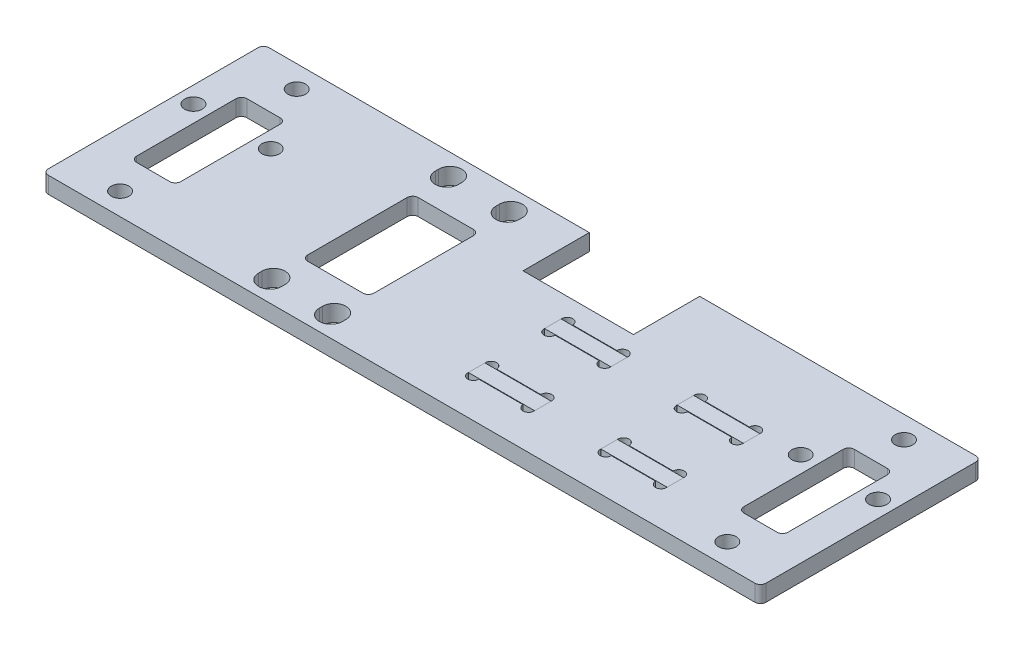
from build123d import *

# Parameters (mm, degrees)
SKETCH_1_W          = 130
SKETCH_1_H          = 40
SKETCH_1_R          = 1.6
EXTRUDE_1_DEPTH     = 3
SKETCH_2_W          = 8
SKETCH_2_H          = 20
CUT_EXTRUDE_1_DEPTH = 69.0734897
SKETCH_7_W          = 20
SKETCH_7_H          = 12
SKETCH_7_R          = 1.6
CUT_EXTRUDE_4_DEPTH = 69.0734897
SKETCH_8_R          = 1
SKETCH_8_W          = 12
SKETCH_8_H          = 3.2
CUT_EXTRUDE_5_DEPTH = 69.0734897
EXTRUDE_2_DEPTH     = 1.5
SKETCH_11_W         = 12
SKETCH_11_H         = 20
CUT_EXTRUDE_6_DEPTH = 69.0734897
FILLET_1_R          = 1


with BuildPart() as part:
    # 草图1 → 凸台-拉伸1 (new body)
    with BuildSketch(Plane(origin=(0, 0, 0), x_dir=(1, 0, 0), z_dir=(0, 1, 0))):
        Rectangle(SKETCH_1_W, SKETCH_1_H)
        with Locations((-55, 16)):
            Circle(SKETCH_1_R, mode=Mode.SUBTRACT)
        with Locations((-55, -16)):
            Circle(SKETCH_1_R, mode=Mode.SUBTRACT)
        with Locations((55, 16)):
            Circle(SKETCH_1_R, mode=Mode.SUBTRACT)
        with Locations((55, -16)):
            Circle(SKETCH_1_R, mode=Mode.SUBTRACT)
        with BuildLine():
            Line((-29.6, 15.7), (-29.6, 16.3))
            ThreePointArc((-29.6, 16.3), (-27.5, 18.4), (-25.4, 16.3))
            Line((-25.4, 16.3), (-25.4, 15.7))
            ThreePointArc((-25.4, 15.7), (-27.5, 13.6), (-29.6, 15.7))
        make_face(mode=Mode.SUBTRACT)
        with BuildLine():
            Line((-18.6, 15.7), (-18.6, 16.3))
            ThreePointArc((-18.6, 16.3), (-16.5, 18.4), (-14.4, 16.3))
            Line((-14.4, 16.3), (-14.4, 15.7))
            ThreePointArc((-14.4, 15.7), (-16.5, 13.6), (-18.6, 15.7))
        make_face(mode=Mode.SUBTRACT)
        with BuildLine():
            Line((-25.4, -15.7), (-25.4, -16.3))
            ThreePointArc((-25.4, -16.3), (-27.5, -18.4), (-29.6, -16.3))
            Line((-29.6, -16.3), (-29.6, -15.7))
            ThreePointArc((-29.6, -15.7), (-27.5, -13.6), (-25.4, -15.7))
        make_face(mode=Mode.SUBTRACT)
        with BuildLine():
            Line((-14.4, -15.7), (-14.4, -16.3))
            ThreePointArc((-14.4, -16.3), (-16.5, -18.4), (-18.6, -16.3))
            Line((-18.6, -16.3), (-18.6, -15.7))
            ThreePointArc((-18.6, -15.7), (-16.5, -13.6), (-14.4, -15.7))
        make_face(mode=Mode.SUBTRACT)
    extrude(amount=EXTRUDE_1_DEPTH)

    # 草图2 → 切除-拉伸1 (cut, through all)
    with BuildSketch(Plane(origin=(0, 3, 0), x_dir=(1, 0, 0), z_dir=(0, 1, 0))):
        with Locations((-55, 0)):
            Rectangle(SKETCH_2_W, SKETCH_2_H)
        with Locations((55, 0)):
            Rectangle(SKETCH_2_W, SKETCH_2_H)
    extrude(amount=-CUT_EXTRUDE_1_DEPTH, mode=Mode.SUBTRACT)

    # 草图7 → 切除-拉伸4 (cut, through all)
    with BuildSketch(Plane.XZ):
        with Locations((4, -14)):
            Rectangle(SKETCH_7_W, SKETCH_7_H)
        with Locations((62, -4.3)):
            Circle(SKETCH_7_R)
        with Locations((48, -4.3)):
            Circle(SKETCH_7_R)
        with Locations((-62, -4.3)):
            Circle(SKETCH_7_R)
        with Locations((-48, -4.3)):
            Circle(SKETCH_7_R)
    extrude(amount=-CUT_EXTRUDE_4_DEPTH, mode=Mode.SUBTRACT)

    # 草图8 → 切除-拉伸5 (cut, through all)
    with BuildSketch(Plane.XZ):
        with Locations((6, -0.8)):
            Circle(SKETCH_8_R)
        with Locations((6, -4)):
            Circle(SKETCH_8_R)
        with Locations((16, -0.8)):
            Circle(SKETCH_8_R)
        with Locations((16, -4)):
            Circle(SKETCH_8_R)
        with Locations((30, -0.8)):
            Circle(SKETCH_8_R)
        with Locations((30, -4)):
            Circle(SKETCH_8_R)
        with Locations((40, -0.8)):
            Circle(SKETCH_8_R)
        with Locations((40, -4)):
            Circle(SKETCH_8_R)
        with Locations((40, 13)):
            Circle(SKETCH_8_R)
        with Locations((40, 9.8)):
            Circle(SKETCH_8_R)
        with Locations((30, 13)):
            Circle(SKETCH_8_R)
        with Locations((30, 9.8)):
            Circle(SKETCH_8_R)
        with Locations((16, 13)):
            Circle(SKETCH_8_R)
        with Locations((16, 9.8)):
            Circle(SKETCH_8_R)
        with Locations((6, 13)):
            Circle(SKETCH_8_R)
        with Locations((6, 9.8)):
            Circle(SKETCH_8_R)
        with Locations((11, -2.4)):
            Rectangle(SKETCH_8_W, SKETCH_8_H)
        with Locations((35, -2.4)):
            Rectangle(SKETCH_8_W, SKETCH_8_H)
        with Locations((35, 11.4)):
            Rectangle(SKETCH_8_W, SKETCH_8_H)
        with Locations((11, 11.4)):
            Rectangle(SKETCH_8_W, SKETCH_8_H)
    extrude(amount=-CUT_EXTRUDE_5_DEPTH, mode=Mode.SUBTRACT)

    # 草图11 → 切除-拉伸6 (cut, through all)
    with BuildSketch(Plane.XZ):
        with Locations((-22, 0)):
            Rectangle(SKETCH_11_W, SKETCH_11_H)
    extrude(amount=-CUT_EXTRUDE_6_DEPTH, mode=Mode.SUBTRACT)

    # 圆角1
    fillet_1_edges = [part.edges().sort_by_distance(p)[0] for p in [
        (65, 1.5, -20),
        (-65, 1.5, -20),
        (-65, 1.5, 20),
        (65, 1.5, 20),
        (51, 1.5, 10),
        (51, 1.5, -10),
        (59, 1.5, -10),
        (-59, 1.5, 10),
        (-59, 1.5, -10),
        (-51, 1.5, -10),
        (-51, 1.5, 10),
        (59, 1.5, 10),
        (-16, 1.5, -10),
        (-28, 1.5, -10),
        (-16, 1.5, 10),
        (-28, 1.5, 10),
    ]]
    fillet(fillet_1_edges, radius=FILLET_1_R)


with BuildPart() as body_2:
    # 草图9 → 凸台-拉伸2 (new, symmetric)
    with BuildSketch(Plane(origin=(0, 0, 11.4), x_dir=(-1, 0, 0), z_dir=(0, 0, -1))):
        with BuildLine():
            Line((-5, 0), (-5, 3))
            Line((-5, 3), (-17, 3))
            Line((-17, 3), (-17, 0))
            ThreePointArc((-17, 0), (-18, -1), (-19, 0))
            Line((-19, 0), (-27, 0))
            ThreePointArc((-27, 0), (-28, -1), (-29, 0))
            Line((-29, 0), (-29, 3))
            Line((-29, 3), (-41, 3))
            Line((-41, 3), (-41, 0))
            ThreePointArc((-41, 0), (-42, -1), (-43, 0))
            Line((-43, 0), (-46, 0))
            Line((-46, 0), (-46, -3))
            Line((-46, -3), (0, -3))
            Line((0, -3), (0, 0))
            Line((0, 0), (-3, 0))
            ThreePointArc((-3, 0), (-4, -1), (-5, 0))
        make_face()
    extrude(amount=EXTRUDE_2_DEPTH, both=True)


with BuildPart() as body_3:
    # 镜向1: mirrored copy
    add(body_2.part.mirror(Plane.XY.offset(4.5)))


solid = Compound([part.part, body_2.part, body_3.part])
